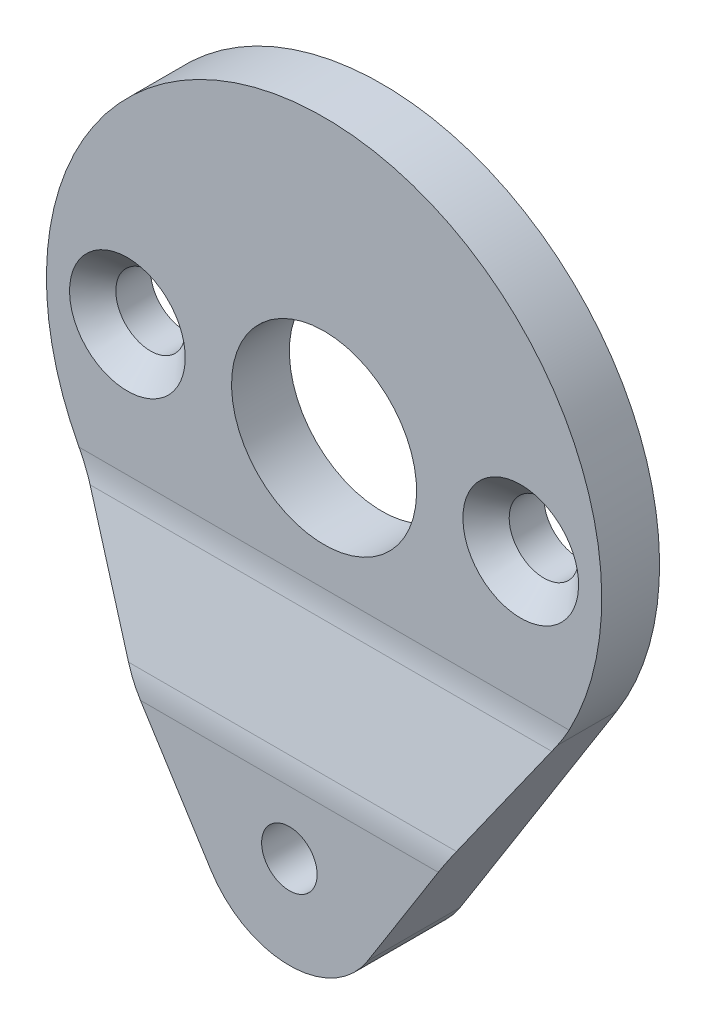
from build123d import *

# Parameters (mm, degrees)
ESQUISSE1_R             = 4
ESQUISSE1_R_2           = 1.2
ESQUISSE1_R_3           = 1.5
BOSS_EXTRU_1_DEPTH      = 4
ENL_V_MAT_EXTRU_1_DEPTH = 25
CHANFREIN1_SIZE         = 1
CONG_1_R                = 4


with BuildPart() as part:
    # Esquisse1 → Boss.-Extru.1 (new body)
    with BuildSketch(Plane.XY):
        with BuildLine():
            Line((-10.150862032, -6.4), (-3.383620677, -17.133333333))
            ThreePointArc((-3.383620677, -17.133333333), (0, -19), (3.383620677, -17.133333333))
            Line((3.383620677, -17.133333333), (10.150862032, -6.4))
            ThreePointArc((10.150862032, -6.4), (0, 12), (-10.150862032, -6.4))
        make_face()
        Circle(ESQUISSE1_R, mode=Mode.SUBTRACT)
        with Locations((0, -15)):
            Circle(ESQUISSE1_R_2, mode=Mode.SUBTRACT)
        with Locations((-8.5, 0)):
            Circle(ESQUISSE1_R_3, mode=Mode.SUBTRACT)
        with Locations((8.5, 0)):
            Circle(ESQUISSE1_R_3, mode=Mode.SUBTRACT)
    extrude(amount=BOSS_EXTRU_1_DEPTH)

    # Esquisse2 → Enlèv. mat.-Extru.1 (cut, symmetric)
    with BuildSketch(Plane(origin=(0, 0, 0), x_dir=(0, 0, -1), z_dir=(1, 0, 0))):
        Polygon((-4, -11.766666667), (-2.5, -6.168590455), (-2.5, 12), (-4, 12), align=None)
    extrude(amount=ENL_V_MAT_EXTRU_1_DEPTH, both=True, mode=Mode.SUBTRACT)

    # Chanfrein1
    chanfrein1_edges = [part.edges().sort_by_distance(p)[0] for p in [
        (-10, 0, 2.5),
        (7, 0, 2.5),
    ]]
    chamfer(chanfrein1_edges, length=CHANFREIN1_SIZE)

    # Congé1
    cong_1_edges = [part.edges().sort_by_distance(p)[0] for p in [
        (0, -6.168590455, 2.5),
        (0, -11.766666667, 4),
    ]]
    fillet(cong_1_edges, radius=CONG_1_R)


solid = part.part
